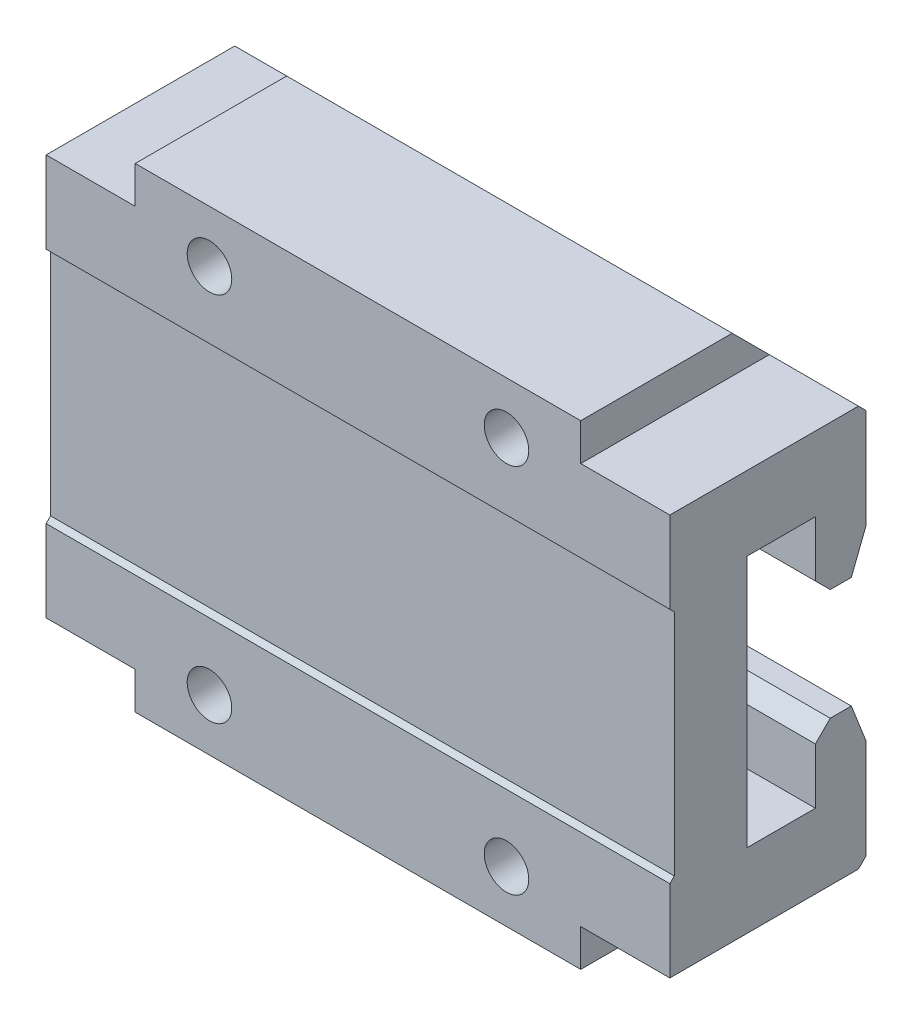
from build123d import *

# Parameters (mm, degrees)
BOSS_EXTRUDE1_DEPTH = 13.2
CUT_EXTRUDE4_DEPTH  = 55.426464151
CUT_EXTRUDE5_DEPTH  = 55.426464151
SKETCH5_R           = 1.5
CUT_EXTRUDE6_DEPTH  = 55.426464151
SKETCH6_R           = 3
CUT_EXTRUDE7_DEPTH  = 2


with BuildPart() as part:
    # Sketch1 → Boss-Extrude1 (new body)
    with BuildSketch(Plane.XY):
        Polygon((0, 29.5), (6, 29.5), (6, 32), (36, 32), (36, 29.5), (42, 29.5), (42, 2.5), (36, 2.5), (36, 0), (6, 0), (6, 2.5), (0, 2.5), align=None)
    extrude(amount=BOSS_EXTRUDE1_DEPTH)

    # Sketch3 → Cut-Extrude4 (cut, through all)
    with BuildSketch(Plane(origin=(0, 0, 0), x_dir=(0, 0, -1), z_dir=(1, 0, 0))):
        Polygon((-2.4, 19.75), (0, 19.75), (0, 12.25), (-2.4, 12.25), (-3.4, 11.25), (-3.4, 7.5), (-8, 7.5), (-8, 24.5), (-3.4, 24.5), (-3.4, 20.75), align=None)
    extrude(amount=CUT_EXTRUDE4_DEPTH, mode=Mode.SUBTRACT)

    # Sketch4 → Cut-Extrude5 (cut, through all)
    with BuildSketch(Plane(origin=(0, 0, 0), x_dir=(0, 0, -1), z_dir=(1, 0, 0))):
        Polygon((-13.2, 24), (-12.9, 23.7), (-12.9, 8.3), (-13.2, 8), align=None)
        Polygon((0, 3), (-3, 0), (0, 0), align=None)
        Polygon((0, 32), (0, 29), (-3, 32), align=None)
        Polygon((-0.98, 12.25), (0, 9.75), (0, 12.25), align=None)
        Polygon((-0.98, 19.75), (0, 22.25), (0, 19.75), align=None)
    extrude(amount=CUT_EXTRUDE5_DEPTH, mode=Mode.SUBTRACT)

    # Sketch5 → Cut-Extrude6 (cut, through all)
    with BuildSketch(Plane.XY.offset(13.2)):
        with Locations((11, 28.5)):
            Circle(SKETCH5_R)
        with Locations((31, 28.5)):
            Circle(SKETCH5_R)
        with Locations((31, 3.5)):
            Circle(SKETCH5_R)
        with Locations((11, 3.5)):
            Circle(SKETCH5_R)
    extrude(amount=-CUT_EXTRUDE6_DEPTH, mode=Mode.SUBTRACT)

    # Sketch6 → Cut-Extrude7 (cut)
    with BuildSketch(Plane(origin=(0, 0, 0), x_dir=(-1, 0, 0), z_dir=(0, 0, -1))):
        with Locations((-31, 28.5)):
            Circle(SKETCH6_R)
        with Locations((-11, 28.5)):
            Circle(SKETCH6_R)
        with Locations((-11, 3.5)):
            Circle(SKETCH6_R)
        with Locations((-31, 3.5)):
            Circle(SKETCH6_R)
    extrude(amount=-CUT_EXTRUDE7_DEPTH, mode=Mode.SUBTRACT)


solid = part.part
